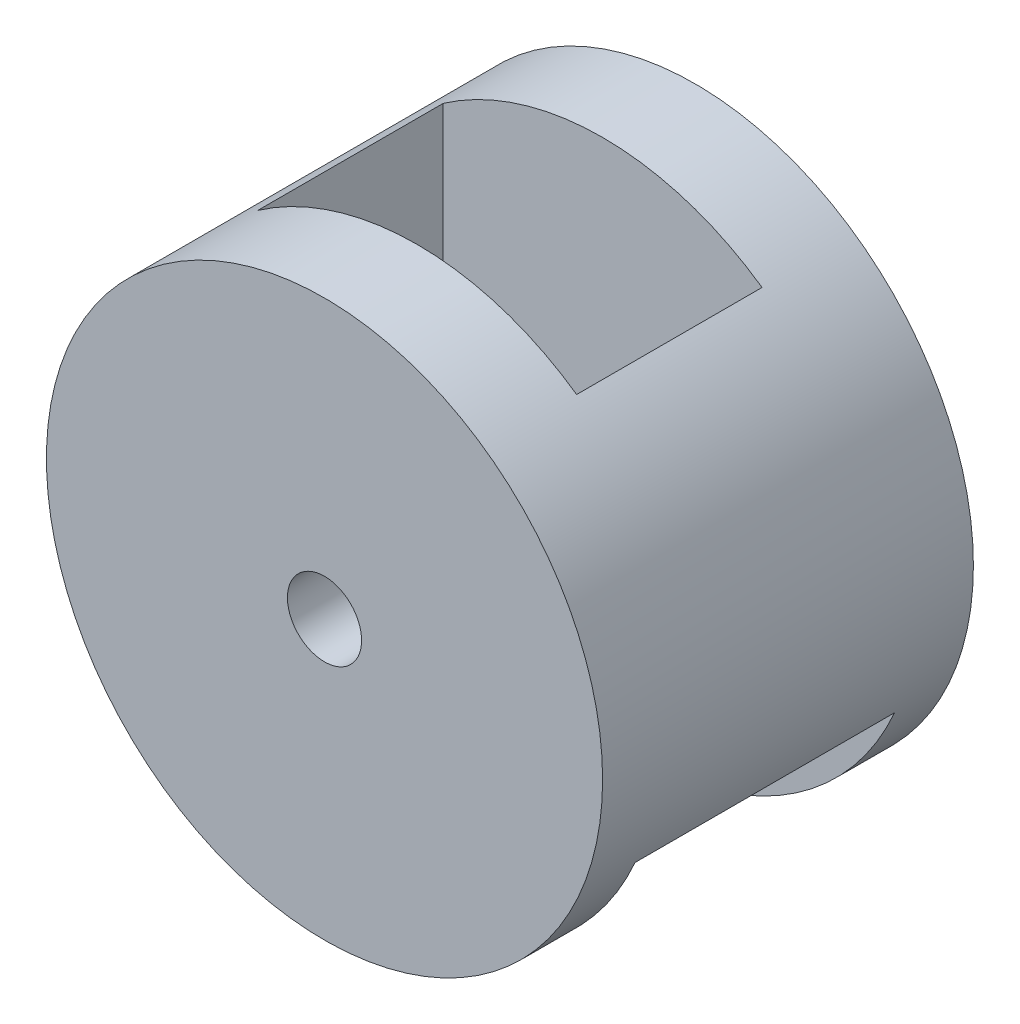
from build123d import *

# Parameters (mm, degrees)
SKETCH_1_R          = 7.5
EXTRUDE_1_DEPTH     = 10
CUT_EXTRUDE_1_DEPTH = 5
SKETCH_3_R          = 1
CUT_EXTRUDE_2_DEPTH = 15.577379737
CUT_EXTRUDE_3_DEPTH = 7


with BuildPart() as part:
    # 草图1 → 凸台-拉伸1 (new body)
    with BuildSketch(Plane.XY):
        Circle(SKETCH_1_R)
    extrude(amount=EXTRUDE_1_DEPTH)

    # 草图2 → 切除-拉伸1 (cut)
    with BuildSketch(Plane(origin=(0, 0, 2.5), x_dir=(-1, 0, 0), z_dir=(0, 0, -1))):
        with BuildLine():
            Line((-4.3, 0), (-4.3, 6.144916598))
            ThreePointArc((-4.3, 6.144916598), (0, 7.5), (4.3, 6.144916598))
            Line((4.3, 6.144916598), (4.3, 0))
            ThreePointArc((4.3, 0), (0, -4.3), (-4.3, 0))
        make_face()
    extrude(amount=-CUT_EXTRUDE_1_DEPTH, mode=Mode.SUBTRACT)

    # 草图3 → 切除-拉伸2 (cut, through all)
    with BuildSketch(Plane(origin=(0, 0, 0), x_dir=(-1, 0, 0), z_dir=(0, 0, -1))):
        Circle(SKETCH_3_R)
    extrude(amount=-CUT_EXTRUDE_2_DEPTH, mode=Mode.SUBTRACT)

    # 草图5 → 切除-拉伸3 (cut)
    with BuildSketch(Plane(origin=(0, 0, 1.5), x_dir=(-1, 0, 0), z_dir=(0, 0, -1))):
        with BuildLine():
            Line((-5.766281297, -3), (-6.873863542, -3))
            ThreePointArc((-6.873863542, -3), (0, -7.5), (6.873863542, -3))
            Line((6.873863542, -3), (5.766281297, -3))
            ThreePointArc((5.766281297, -3), (0, -6.5), (-5.766281297, -3))
        make_face()
    extrude(amount=-CUT_EXTRUDE_3_DEPTH, mode=Mode.SUBTRACT)


solid = part.part
